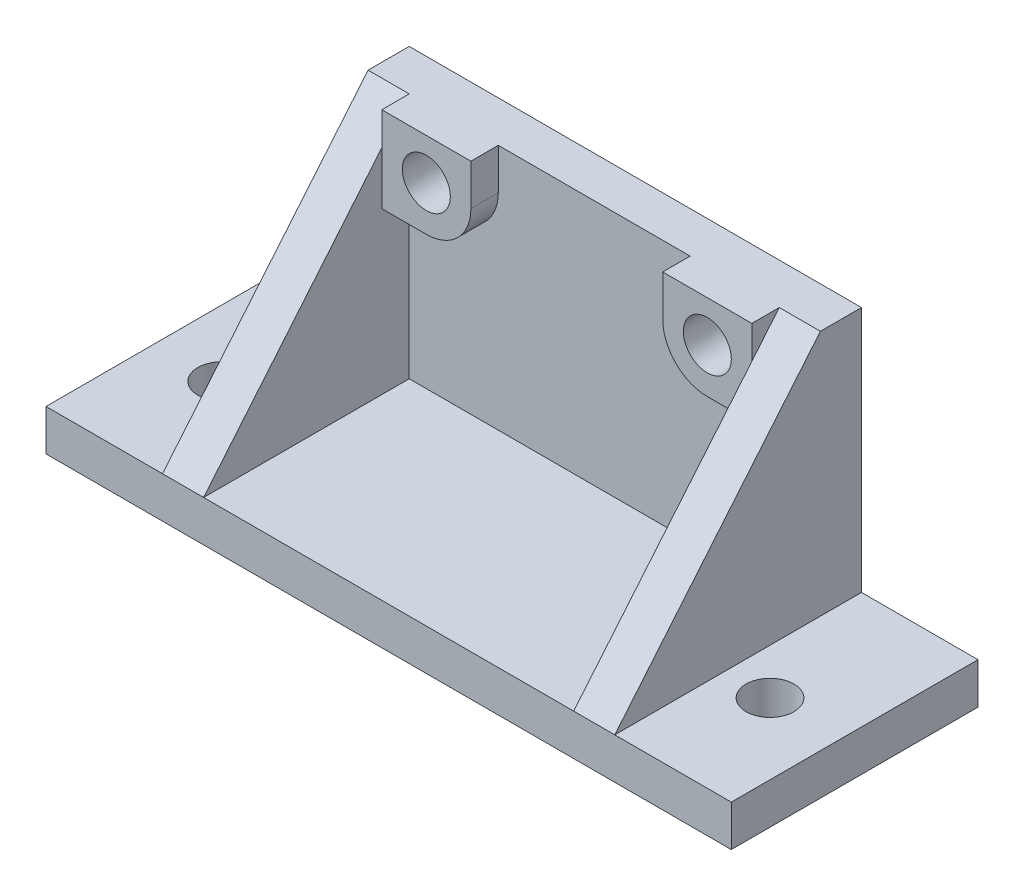
from build123d import *

# Parameters (mm, degrees)
CROQUIS1_W              = 33
CROQUIS1_H              = 21
CROQUIS1_R              = 1.75
SALIENTE_EXTRUIR1_DEPTH = 3
SALIENTE_EXTRUIR2_DEPTH = 15
CORTAR_EXTRUIR1_DEPTH   = 44.058100283
CROQUIS4_W              = 8.5
CROQUIS4_H              = 18
SALIENTE_EXTRUIR3_DEPTH = 3
CROQUIS5_R              = 1.75
SALIENTE_EXTRUIR4_DEPTH = 2
CROQUIS8_R              = 1.75
CORTAR_EXTRUIR4_DEPTH   = 50.872337022


with BuildPart() as part:
    # Croquis1 → Saliente-Extruir1 (new body)
    with BuildSketch(Plane.XY):
        with Locations((16.5, -10.5)):
            Rectangle(CROQUIS1_W, CROQUIS1_H)
        with Locations((6.25, -3)):
            Circle(CROQUIS1_R, mode=Mode.SUBTRACT)
        with Locations((26.75, -3)):
            Circle(CROQUIS1_R, mode=Mode.SUBTRACT)
    extrude(amount=SALIENTE_EXTRUIR1_DEPTH)

    # Croquis2 → Saliente-Extruir2 (add)
    with BuildSketch(Plane.XY.offset(3)):
        Polygon((0, 0), (0, -21), (33, -21), (33, 0), (30, 0), (30, -18), (3, -18), (3, 0), align=None)
    extrude(amount=SALIENTE_EXTRUIR2_DEPTH)

    # Croquis3 → Cortar-Extruir1 (cut, through all)
    with BuildSketch(Plane.ZY):
        Polygon((3, 0), (18, -18), (18, 0), align=None)
    extrude(amount=-CORTAR_EXTRUIR1_DEPTH, mode=Mode.SUBTRACT)

    # Croquis4 → Saliente-Extruir3 (add)
    with BuildSketch(Plane(origin=(0, -18, 0), x_dir=(1, 0, 0), z_dir=(0, 1, 0))):
        with Locations((-4.25, -9)):
            Rectangle(CROQUIS4_W, CROQUIS4_H)
        with Locations((37.25, -9)):
            Rectangle(CROQUIS4_W, CROQUIS4_H)
    extrude(amount=-SALIENTE_EXTRUIR3_DEPTH)

    # Croquis5 → Saliente-Extruir4 (add)
    # profile 1 of 2: a face of its own
    with BuildSketch(Plane.XY.offset(3)):
        with BuildLine():
            Line((6.25, -6.25), (3, -6.25))
            Line((3, -6.25), (3, 0))
            Line((3, 0), (9.5, 0))
            Line((9.5, 0), (9.5, -3))
            ThreePointArc((9.5, -3), (8.548097039, -5.298097039), (6.25, -6.25))
        make_face()
        with Locations((6.25, -3)):
            Circle(CROQUIS5_R, mode=Mode.SUBTRACT)
    # profile 2 of 2: a face of its own
    with BuildSketch(Plane.XY.offset(3)):
        with BuildLine():
            Line((23.5, 0), (23.5, -3))
            ThreePointArc((23.5, -3), (24.451902961, -5.298097039), (26.75, -6.25))
            Line((26.75, -6.25), (30, -6.25))
            Line((30, -6.25), (30, 0))
            Line((30, 0), (23.5, 0))
        make_face()
        with Locations((26.75, -3)):
            Circle(CROQUIS5_R, mode=Mode.SUBTRACT)
    extrude(amount=SALIENTE_EXTRUIR4_DEPTH)

    # Croquis8 → Cortar-Extruir4 (cut, through all)
    with BuildSketch(Plane.XZ.offset(21)):
        with Locations(Location((-3.675, 10, 0), (0, 0, 270))):
            Circle(CROQUIS8_R)
        with Locations(Location((36.325, 10, 0), (0, 0, 270))):
            Circle(CROQUIS8_R)
    extrude(amount=-CORTAR_EXTRUIR4_DEPTH, mode=Mode.SUBTRACT)


solid = part.part
